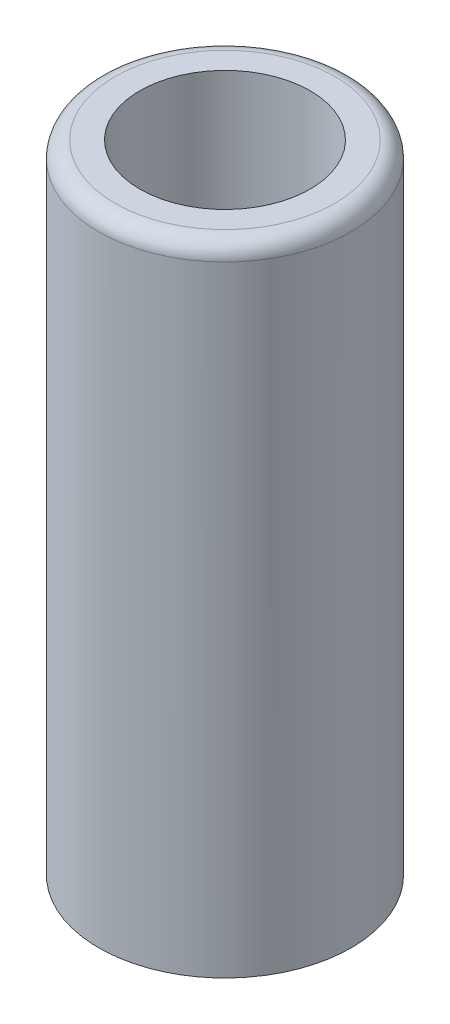
from build123d import *

# Parameters (mm, degrees)
SKETCH1_R           = 15.375
SKETCH1_R_2         = 10.375
BOSS_EXTRUDE1_DEPTH = 25
BOSS_EXTRUDE2_START = 52.5
SKETCH3_R           = 15.375
BOSS_EXTRUDE2_DEPTH = 52.5
FILLET1_R           = 2


with BuildPart() as part:
    # Sketch1 → Boss-Extrude1 (new body)
    with BuildSketch(Plane(origin=(0, 0, 0), x_dir=(1, 0, 0), z_dir=(0, 1, 0))):
        with Locations(Location((0, 0, 0), (0, 0, 270))):
            Circle(SKETCH1_R)
        with Locations(Location((0, 0, 0), (0, 0, 270))):
            Circle(SKETCH1_R_2, mode=Mode.SUBTRACT)
    extrude(amount=BOSS_EXTRUDE1_DEPTH)

    # Sketch3 → Boss-Extrude2 (add)
    with BuildSketch(Plane.XZ.offset(BOSS_EXTRUDE2_START)):
        with Locations(Location((0, 0, 0), (0, 0, 270))):
            Circle(SKETCH3_R)
    extrude(amount=-BOSS_EXTRUDE2_DEPTH)

    # Fillet1
    fillet1_edges = [part.edges().sort_by_distance(p)[0] for p in [
        (0, 25, -15.375),
        (0, 0, -10.375),
    ]]
    fillet(fillet1_edges, radius=FILLET1_R)


solid = part.part
